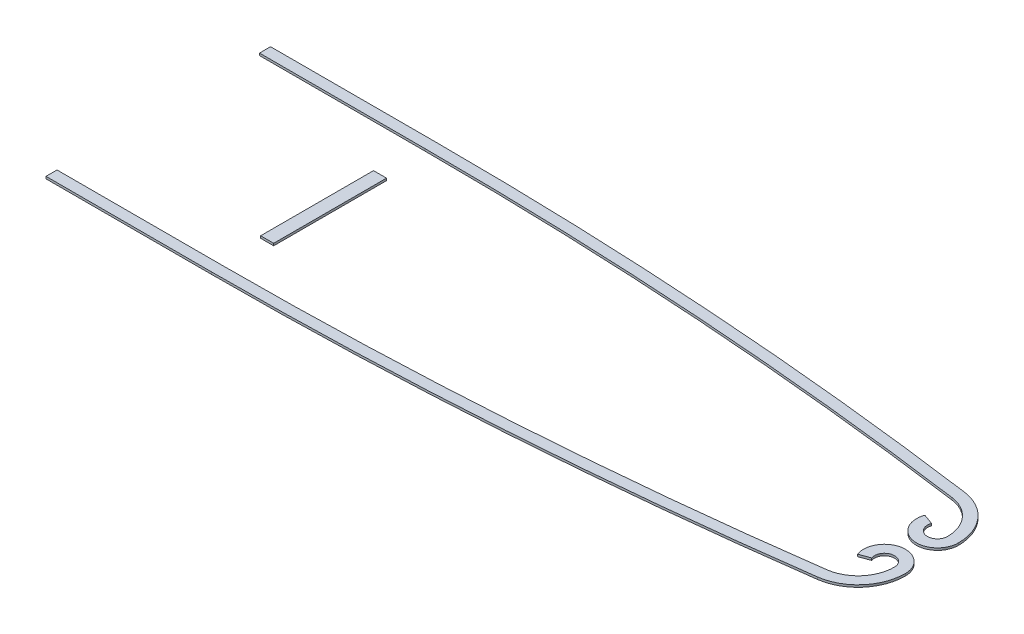
from build123d import *

# Parameters (mm, degrees)
BOSS_EXTRUDE1_DEPTH   = 0.5
BOSS_EXTRUDE1_2_DEPTH = 0.5
SKETCH1_W             = 5.91
SKETCH1_H             = 51.2
BOSS_EXTRUDE1_3_DEPTH = 0.5


with BuildPart() as part:
    # Sketch1 → Boss-Extrude1 (new, symmetric)
    with BuildSketch(Plane(origin=(0, 0, 0), x_dir=(1, 0, 0), z_dir=(0, 1, 0))):
        with BuildLine():
            Line((0, 50.931890821), (-75, 50.931890821))
            Line((-75, 50.931890821), (-75, 45.931890821))
            Line((-75, 45.931890821), (0, 45.931890821))
            ThreePointArc((0, 45.931890821), (128.67499242, 41.536963002), (256.750244878, 28.372663821))
            ThreePointArc((256.750244878, 28.372663821), (266.940818335, 22.869862332), (271.005, 12.025))
            ThreePointArc((271.005, 12.025), (265.694357424, 7.568724566), (262.227810722, 13.572420868))
            Line((262.227810722, 13.572420868), (257.529259033, 15.28227818))
            ThreePointArc((257.529259033, 15.28227818), (264.826244079, 2.644663313), (276.005, 12.025))
            ThreePointArc((276.005, 12.025), (270.709345615, 26.155924129), (257.430964024, 33.326109233))
            ThreePointArc((257.430964024, 33.326109233), (129.016147035, 46.525310778), (0, 50.931890821))
        make_face()
    extrude(amount=BOSS_EXTRUDE1_DEPTH, both=True)


with BuildPart() as body_2:
    # Sketch1 → Boss-Extrude1 2 (new, symmetric)
    with BuildSketch(Plane(origin=(0, 0, 0), x_dir=(1, 0, 0), z_dir=(0, 1, 0))):
        with BuildLine():
            Line((262.227810722, -13.572420868), (257.529259033, -15.28227818))
            ThreePointArc((257.529259033, -15.28227818), (264.826244079, -2.644663313), (276.005, -12.025))
            ThreePointArc((276.005, -12.025), (270.709345615, -26.155924129), (257.430964024, -33.326109233))
            ThreePointArc((257.430964024, -33.326109233), (129.016147035, -46.525310778), (0, -50.931890821))
            Line((0, -50.931890821), (-75, -50.931890821))
            Line((-75, -50.931890821), (-75, -45.931890821))
            Line((-75, -45.931890821), (0, -45.931890821))
            ThreePointArc((0, -45.931890821), (128.67499242, -41.536963002), (256.750244878, -28.372663821))
            ThreePointArc((256.750244878, -28.372663821), (266.940818335, -22.869862332), (271.005, -12.025))
            ThreePointArc((271.005, -12.025), (265.694357424, -7.568724566), (262.227810722, -13.572420868))
        make_face()
    extrude(amount=BOSS_EXTRUDE1_2_DEPTH, both=True)


with BuildPart() as body_3:
    # Sketch1 → Boss-Extrude1 3 (new, symmetric)
    with BuildSketch(Plane(origin=(0, 0, 0), x_dir=(1, 0, 0), z_dir=(0, 1, 0))):
        Rectangle(SKETCH1_W, SKETCH1_H)
    extrude(amount=BOSS_EXTRUDE1_3_DEPTH, both=True)


solid = Compound([part.part, body_2.part, body_3.part])
